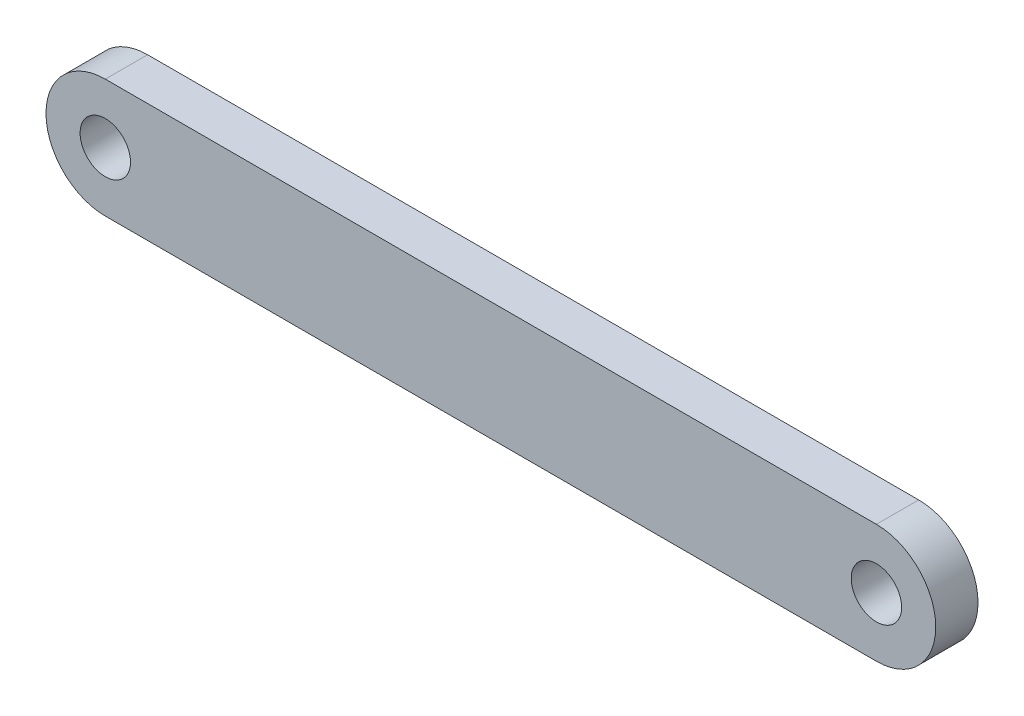
from build123d import *

# Parameters (mm, degrees)
SKETCH1_W           = 60
SKETCH1_H           = 8
BOSS_EXTRUDE1_DEPTH = 2.85
CUT_EXTRUDE1_DEPTH  = 31.399383217
SKETCH3_R           = 1.7
CUT_EXTRUDE2_DEPTH  = 31.399383217


with BuildPart() as part:
    # Sketch1 → Boss-Extrude1 (new body)
    with BuildSketch(Plane.XY):
        Rectangle(SKETCH1_W, SKETCH1_H)
    extrude(amount=BOSS_EXTRUDE1_DEPTH)

    # Sketch2 → Cut-Extrude1 (cut, through all)
    with BuildSketch(Plane.XY.offset(2.85)):
        with BuildLine():
            Line((26, -4), (31, -4))
            Line((31, -4), (31, 4))
            Line((31, 4), (26, 4))
            ThreePointArc((26, 4), (30, 0), (26, -4))
        make_face()
    cut_extrude1 = extrude(amount=-CUT_EXTRUDE1_DEPTH, mode=Mode.SUBTRACT)

    # Sketch3 → Cut-Extrude2 (cut, through all)
    with BuildSketch(Plane.XY.offset(2.85)):
        with Locations((26, 0)):
            Circle(SKETCH3_R)
    cut_extrude2 = extrude(amount=-CUT_EXTRUDE2_DEPTH, mode=Mode.SUBTRACT)

    # Mirror1: Cut-Extrude1, Cut-Extrude2 across plane
    add(cut_extrude1.mirror(Plane(origin=(0, 0, 0), x_dir=(0, 0, 1), z_dir=(1, 0, 0))), mode=Mode.SUBTRACT)
    add(cut_extrude2.mirror(Plane(origin=(0, 0, 0), x_dir=(0, 0, 1), z_dir=(1, 0, 0))), mode=Mode.SUBTRACT)


solid = part.part
